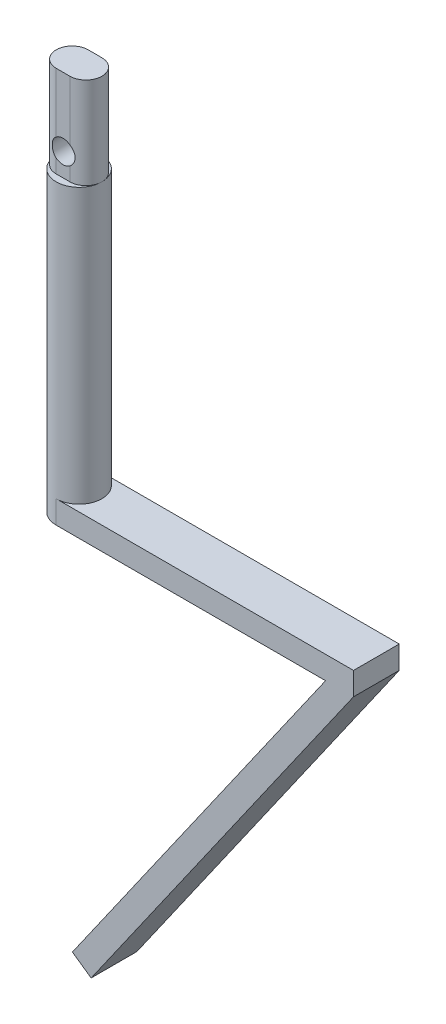
from build123d import *

# Parameters (mm, degrees)
SKETCH1_R           = 5
BOSS_EXTRUDE1_DEPTH = 60
BOSS_EXTRUDE2_DEPTH = 20
SKETCH3_R           = 2.5
CUT_EXTRUDE1_DEPTH  = 15
BOSS_EXTRUDE3_START = 5
BOSS_EXTRUDE3_DEPTH = 5
BOSS_EXTRUDE5_DEPTH = 10


with BuildPart() as part:
    # Sketch1 → Boss-Extrude1 (new body)
    with BuildSketch(Plane(origin=(0, 0, 0), x_dir=(1, 0, 0), z_dir=(0, 1, 0))):
        with Locations(Location((0, 0, 0), (0, 0, 270))):
            Circle(SKETCH1_R)
    extrude(amount=BOSS_EXTRUDE1_DEPTH)

    # Sketch2 → Boss-Extrude2 (add)
    with BuildSketch(Plane(origin=(0, 60, 0), x_dir=(1, 0, 0), z_dir=(0, 1, 0))):
        with BuildLine():
            Line((1.5, -3.5), (-1.5, -3.5))
            ThreePointArc((-1.5, -3.5), (-5, 0), (-1.5, 3.5))
            Line((-1.5, 3.5), (1.5, 3.5))
            ThreePointArc((1.5, 3.5), (5, 0), (1.5, -3.5))
        make_face()
    extrude(amount=BOSS_EXTRUDE2_DEPTH)

    # Sketch3 → Cut-Extrude1 (cut)
    with BuildSketch(Plane.XY.offset(3.5)):
        with Locations(Location((0, 65, 0), (0, 0, 306.869897646))):
            Circle(SKETCH3_R)
    extrude(amount=-CUT_EXTRUDE1_DEPTH, mode=Mode.SUBTRACT)

    # Sketch4 → Boss-Extrude3 (add)
    with BuildSketch(Plane.XZ.offset(BOSS_EXTRUDE3_START)):
        with BuildLine():
            Line((0, 5), (65, 5))
            Line((65, 5), (65, -5))
            Line((65, -5), (0, -5))
            ThreePointArc((0, -5), (-5, 0), (0, 5))
        make_face()
    extrude(amount=-BOSS_EXTRUDE3_DEPTH)

    # Sketch6 → Boss-Extrude5 (add)
    with BuildSketch(Plane.XY.offset(5)):
        Polygon((65, -5), (7.642356365, -86.915204429), (3.546596143, -84.047322247), (58.896127056, -5), align=None)
    extrude(amount=-BOSS_EXTRUDE5_DEPTH)


solid = part.part
